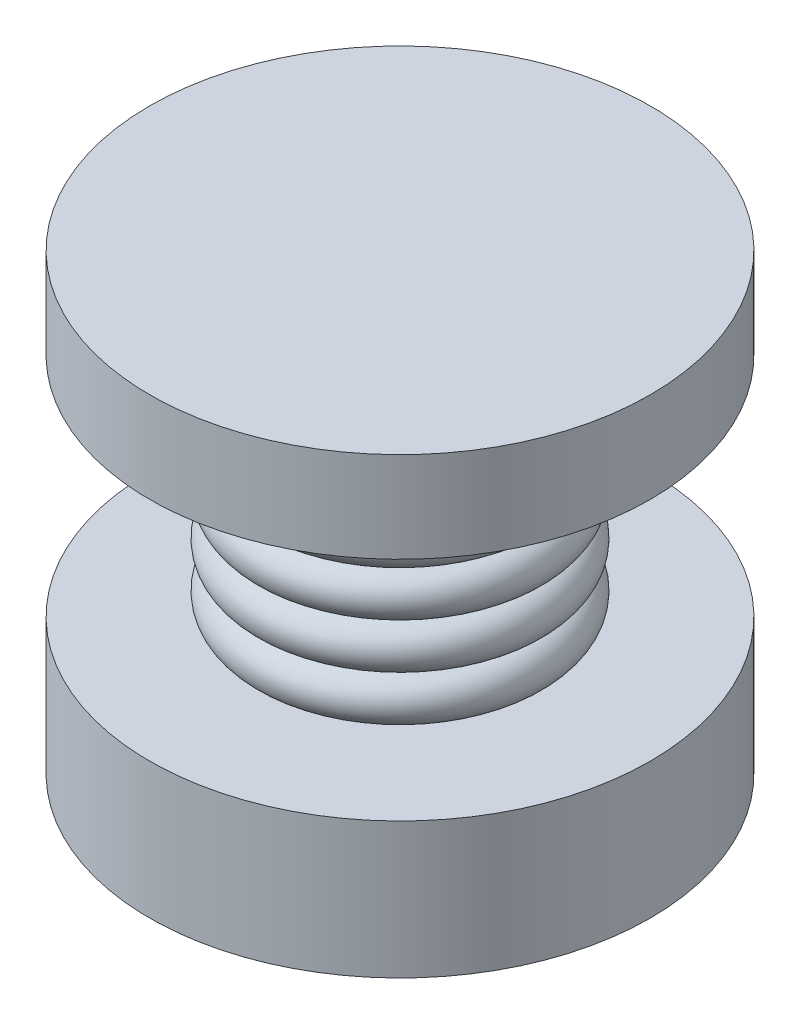
from build123d import *


with BuildPart() as part:
    # Эскиз1 → Повернуть1 (revolve)
    with BuildSketch(Plane.XY):
        with BuildLine():
            Line((-2.760861551, 0), (0, 0))
            Line((0, 0), (0, 5))
            Line((0, 5), (-2.760861551, 5))
            Line((-2.760861551, 5), (-2.760861551, 4))
            Line((-2.760861551, 4), (-1.380430776, 4))
            ThreePointArc((-1.380430776, 4), (-1.20365408, 3.926776695), (-1.130430776, 3.75))
            ThreePointArc((-1.130430776, 3.75), (-1.20365408, 3.573223305), (-1.380430776, 3.5))
            ThreePointArc((-1.380430776, 3.5), (-1.20365408, 3.426776695), (-1.130430776, 3.25))
            ThreePointArc((-1.130430776, 3.25), (-1.20365408, 3.073223305), (-1.380430776, 3))
            ThreePointArc((-1.380430776, 3), (-1.20365408, 2.926776695), (-1.130430776, 2.75))
            ThreePointArc((-1.130430776, 2.75), (-1.20365408, 2.573223305), (-1.380430776, 2.5))
            ThreePointArc((-1.380430776, 2.5), (-1.20365408, 2.426776695), (-1.130430776, 2.25))
            ThreePointArc((-1.130430776, 2.25), (-1.20365408, 2.073223305), (-1.380430776, 2))
            ThreePointArc((-1.380430776, 2), (-1.20365408, 1.926776695), (-1.130430776, 1.75))
            ThreePointArc((-1.130430776, 1.75), (-1.20365408, 1.573223305), (-1.380430776, 1.5))
            Line((-1.380430776, 1.5), (-2.760861551, 1.5))
            Line((-2.760861551, 1.5), (-2.760861551, 0))
        make_face()
        with BuildLine():
            ThreePointArc((-1.130430776, 3.75), (-1.20365408, 3.926776695), (-1.380430776, 4))
            Line((-1.380430776, 4), (-1.380430776, 3.5))
            ThreePointArc((-1.380430776, 3.5), (-1.20365408, 3.573223305), (-1.130430776, 3.75))
        make_face()
        with BuildLine():
            Line((-1.380430776, 3.5), (-1.380430776, 4))
            ThreePointArc((-1.380430776, 4), (-1.630430776, 3.75), (-1.380430776, 3.5))
        make_face()
        with BuildLine():
            ThreePointArc((-1.130430776, 3.25), (-1.20365408, 3.426776695), (-1.380430776, 3.5))
            Line((-1.380430776, 3.5), (-1.380430776, 3))
            ThreePointArc((-1.380430776, 3), (-1.20365408, 3.073223305), (-1.130430776, 3.25))
        make_face()
        with BuildLine():
            Line((-1.380430776, 3), (-1.380430776, 3.5))
            ThreePointArc((-1.380430776, 3.5), (-1.630430776, 3.25), (-1.380430776, 3))
        make_face()
        with BuildLine():
            ThreePointArc((-1.380430776, 3), (-1.630430776, 2.75), (-1.380430776, 2.5))
            Line((-1.380430776, 2.5), (-1.380430776, 3))
        make_face()
        with BuildLine():
            Line((-1.380430776, 3), (-1.380430776, 2.5))
            ThreePointArc((-1.380430776, 2.5), (-1.20365408, 2.573223305), (-1.130430776, 2.75))
            ThreePointArc((-1.130430776, 2.75), (-1.20365408, 2.926776695), (-1.380430776, 3))
        make_face()
        with BuildLine():
            ThreePointArc((-1.380430776, 2), (-1.630430776, 1.75), (-1.380430776, 1.5))
            Line((-1.380430776, 1.5), (-1.380430776, 2))
        make_face()
        with BuildLine():
            Line((-1.380430776, 2), (-1.380430776, 1.5))
            ThreePointArc((-1.380430776, 1.5), (-1.20365408, 1.573223305), (-1.130430776, 1.75))
            ThreePointArc((-1.130430776, 1.75), (-1.20365408, 1.926776695), (-1.380430776, 2))
        make_face()
        with BuildLine():
            ThreePointArc((-1.380430776, 2.5), (-1.630430776, 2.25), (-1.380430776, 2))
            Line((-1.380430776, 2), (-1.380430776, 2.5))
        make_face()
        with BuildLine():
            Line((-1.380430776, 2.5), (-1.380430776, 2))
            ThreePointArc((-1.380430776, 2), (-1.20365408, 2.073223305), (-1.130430776, 2.25))
            ThreePointArc((-1.130430776, 2.25), (-1.20365408, 2.426776695), (-1.380430776, 2.5))
        make_face()
    revolve(axis=Axis((0, 5, 0), (0, -1, 0)))


solid = part.part
